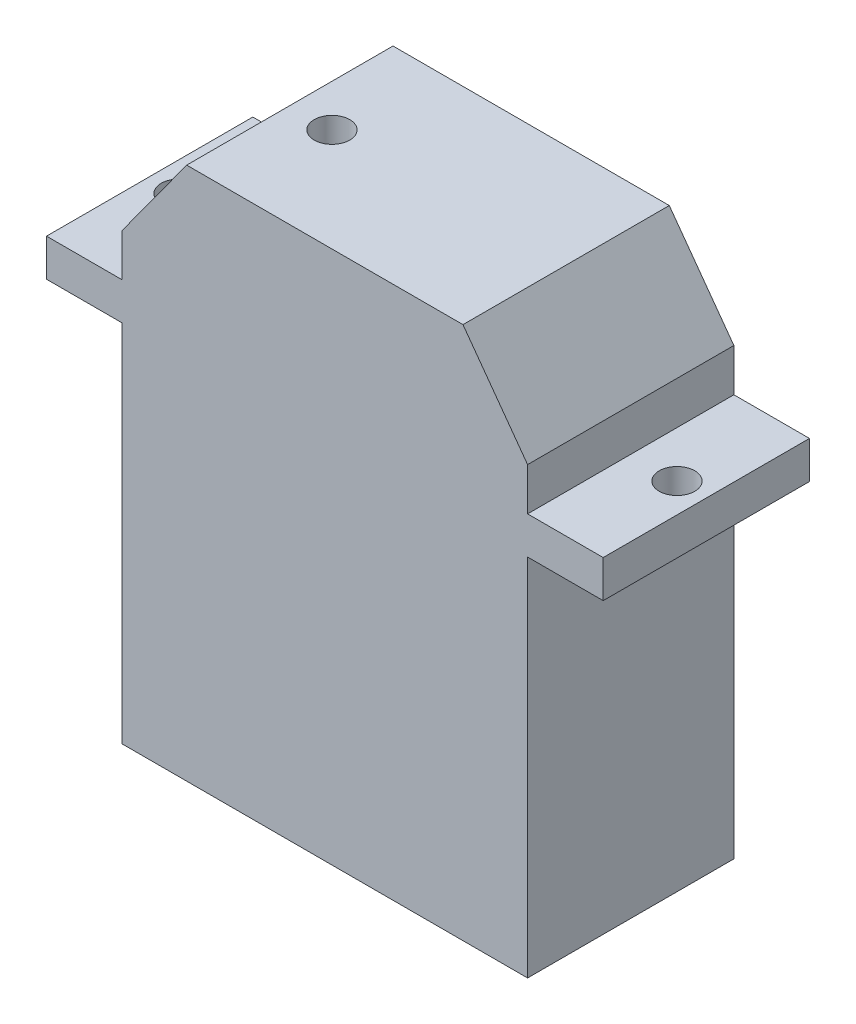
from build123d import *
from OCP.BRepFilletAPI import BRepFilletAPI_MakeChamfer

# Parameters (mm, degrees)
SKETCH1_W           = 22.8
SKETCH1_H           = 30
BOSS_EXTRUDE1_DEPTH = 11.6
SKETCH3_W           = 4.25
SKETCH3_H           = 2.1
BOSS_EXTRUDE2_DEPTH = 11.6
SKETCH4_R           = 1
CUT_EXTRUDE1_DEPTH  = 11.6
SKETCH2_R           = 1
CUT_EXTRUDE2_DEPTH  = 5
CHAMFER1_SIZE       = 5
CHAMFER1_SIZE2      = 3.63271264


with BuildPart() as part:
    # Sketch1 → Boss-Extrude1 (new body)
    with BuildSketch(Plane.XY):
        Rectangle(SKETCH1_W, SKETCH1_H)
    extrude(amount=BOSS_EXTRUDE1_DEPTH)

    # Sketch3 → Boss-Extrude2 (add)
    with BuildSketch(Plane.XY.offset(11.6)):
        with Locations((-13.525, 6.55)):
            Rectangle(SKETCH3_W, SKETCH3_H)
        with Locations((13.525, 6.55)):
            Rectangle(SKETCH3_W, SKETCH3_H)
    extrude(amount=-BOSS_EXTRUDE2_DEPTH)

    # Sketch4 → Cut-Extrude1 (cut)
    with BuildSketch(Plane(origin=(0, 7.6, 0), x_dir=(1, 0, 0), z_dir=(0, 1, 0))):
        with Locations(Location((-14, -5.8, 0), (0, 0, 180))):
            Circle(SKETCH4_R)
        with Locations(Location((14, -5.8, 0), (0, 0, 90))):
            Circle(SKETCH4_R)
    extrude(amount=-CUT_EXTRUDE1_DEPTH, mode=Mode.SUBTRACT)

    # Sketch2 → Cut-Extrude2 (cut)
    with BuildSketch(Plane(origin=(0, 15, 0), x_dir=(1, 0, 0), z_dir=(0, 1, 0))):
        with Locations(Location((-5.4, -5.8, 0), (0, 0, 270))):
            Circle(SKETCH2_R)
    extrude(amount=-CUT_EXTRUDE2_DEPTH, mode=Mode.SUBTRACT)

    # Chamfer1: one chamfer whose edges measure the first distance from different faces: ONE call of the kernel's chamfer builder (chamfer() names one face for all edges)
    chamfer1_edges_1 = [part.edges().sort_by_distance(p)[0] for p in [
        (-11.4, 15, 5.8),
    ]]
    chamfer1_side_1 = [part.faces().sort_by_distance(p)[0] for p in [
        (-11.4, 11.3, 5.8),
    ]]
    chamfer1_edges_2 = [part.edges().sort_by_distance(p)[0] for p in [
        (11.4, 15, 5.8),
    ]]
    chamfer1_side_2 = [part.faces().sort_by_distance(p)[0] for p in [
        (11.4, 11.3, 5.8),
    ]]
    chamfer1 = BRepFilletAPI_MakeChamfer(part.part.solid().wrapped)
    for e in chamfer1_edges_1:
        chamfer1.Add(CHAMFER1_SIZE, CHAMFER1_SIZE2, e.wrapped, chamfer1_side_1[0].wrapped)  # the first distance lies on this face
    for e in chamfer1_edges_2:
        chamfer1.Add(CHAMFER1_SIZE, CHAMFER1_SIZE2, e.wrapped, chamfer1_side_2[0].wrapped)  # the first distance lies on this face
    add(Compound.cast(chamfer1.Shape()), mode=Mode.REPLACE)


solid = part.part
